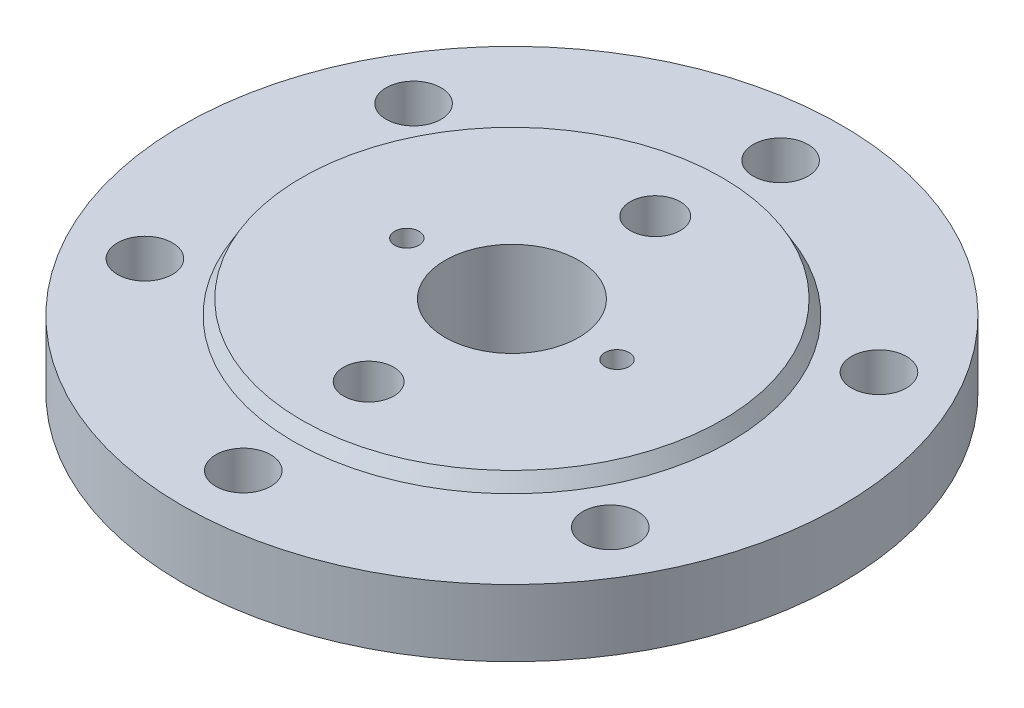
from build123d import *

# Parameters (mm, degrees)
CUT_EXTRUDE1_REACH     = 213.303
SKETCH2_R              = 11.5
M24_TAPPED_HOLE1_D     = 21
M24_TAPPED_HOLE1_DEPTH = 17.6909635
M24_TAPPED_HOLE1_TIP   = 6.3090365
M12_TAPPED_HOLE1_D     = 10.2
M12_TAPPED_HOLE1_DEPTH = 8.935610843
M12_TAPPED_HOLE1_TIP   = 3.064389157


with BuildPart() as part:
    # Sketch1 → Revolve1 (revolve)
    with BuildSketch(Plane.XY, mode=Mode.PRIVATE) as revolve1_sk:
        Polygon((14, -37.771370899), (14, -8.704913174), (28, -0.622009405), (28, 49.228629101), (88, 49.228629101), (91.464101615, 43.228629101), (138, 43.228629101), (138, 15.228629101), (59.901806028, 15.228629101), (59.901806028, 9.228629101), (35, -37.771370899), align=None)
    revolve(revolve1_sk.sketch.rotate(Axis((0, 62.992349216, 0), (0, -1, 0)), 90), axis=Axis((0, 62.992349216, 0), (0, -1, 0)))

    # Sketch2 → Cut-Extrude1 (cut, up to next)
    with BuildSketch(Plane(origin=(0, 43.228629101, 0), x_dir=(1, 0, 0), z_dir=(0, 1, 0)), mode=Mode.PRIVATE) as cut_extrude1_sk1:
        with Locations(Location((0, 112.5, 0), (0, 0, 270))):
            Circle(SKETCH2_R)
    cut_extrude1_tool1 = extrude(cut_extrude1_sk1.sketch, amount=-CUT_EXTRUDE1_REACH, mode=Mode.PRIVATE) & part.part
    # Sketch2 → Cut-Extrude1 (cut, up to next)
    with BuildSketch(Plane(origin=(0, 43.228629101, 0), x_dir=(1, 0, 0), z_dir=(0, 1, 0)), mode=Mode.PRIVATE) as cut_extrude1_sk2:
        with Locations(Location((97.427857926, 56.25, 0), (0, 0, 270))):
            Circle(SKETCH2_R)
    cut_extrude1_tool2 = extrude(cut_extrude1_sk2.sketch, amount=-CUT_EXTRUDE1_REACH, mode=Mode.PRIVATE) & part.part
    # Sketch2 → Cut-Extrude1 (cut, up to next)
    with BuildSketch(Plane(origin=(0, 43.228629101, 0), x_dir=(1, 0, 0), z_dir=(0, 1, 0)), mode=Mode.PRIVATE) as cut_extrude1_sk3:
        with Locations(Location((97.427857926, -56.25, 0), (0, 0, 270))):
            Circle(SKETCH2_R)
    cut_extrude1_tool3 = extrude(cut_extrude1_sk3.sketch, amount=-CUT_EXTRUDE1_REACH, mode=Mode.PRIVATE) & part.part
    # Sketch2 → Cut-Extrude1 (cut, up to next)
    with BuildSketch(Plane(origin=(0, 43.228629101, 0), x_dir=(1, 0, 0), z_dir=(0, 1, 0)), mode=Mode.PRIVATE) as cut_extrude1_sk4:
        with Locations(Location((0, -112.5, 0), (0, 0, 270))):
            Circle(SKETCH2_R)
    cut_extrude1_tool4 = extrude(cut_extrude1_sk4.sketch, amount=-CUT_EXTRUDE1_REACH, mode=Mode.PRIVATE) & part.part
    # Sketch2 → Cut-Extrude1 (cut, up to next)
    with BuildSketch(Plane(origin=(0, 43.228629101, 0), x_dir=(1, 0, 0), z_dir=(0, 1, 0)), mode=Mode.PRIVATE) as cut_extrude1_sk5:
        with Locations(Location((-97.427857926, -56.25, 0), (0, 0, 270))):
            Circle(SKETCH2_R)
    cut_extrude1_tool5 = extrude(cut_extrude1_sk5.sketch, amount=-CUT_EXTRUDE1_REACH, mode=Mode.PRIVATE) & part.part
    # Sketch2 → Cut-Extrude1 (cut, up to next)
    with BuildSketch(Plane(origin=(0, 43.228629101, 0), x_dir=(1, 0, 0), z_dir=(0, 1, 0)), mode=Mode.PRIVATE) as cut_extrude1_sk6:
        with Locations(Location((-97.427857926, 56.25, 0), (0, 0, 270))):
            Circle(SKETCH2_R)
    cut_extrude1_tool6 = extrude(cut_extrude1_sk6.sketch, amount=-CUT_EXTRUDE1_REACH, mode=Mode.PRIVATE) & part.part
    add(cut_extrude1_tool1.solids().sort_by_distance((0, 43.228629, -112.5))[0], mode=Mode.SUBTRACT)
    add(cut_extrude1_tool2.solids().sort_by_distance((97.427858, 43.228629, -56.25))[0], mode=Mode.SUBTRACT)
    add(cut_extrude1_tool3.solids().sort_by_distance((97.427858, 43.228629, 56.25))[0], mode=Mode.SUBTRACT)
    add(cut_extrude1_tool4.solids().sort_by_distance((0, 43.228629, 112.5))[0], mode=Mode.SUBTRACT)
    add(cut_extrude1_tool5.solids().sort_by_distance((-97.427858, 43.228629, 56.25))[0], mode=Mode.SUBTRACT)
    add(cut_extrude1_tool6.solids().sort_by_distance((-97.427858, 43.228629, -56.25))[0], mode=Mode.SUBTRACT)

    # M24 Tapped Hole1
    with Locations(Plane(origin=(0, 49.228629101, -60), x_dir=(0, 0, 1), z_dir=(0, 1, 0))):
        with Locations((0, 0), (120, 0)):
            Hole(M24_TAPPED_HOLE1_D / 2, depth=M24_TAPPED_HOLE1_DEPTH)
            with Locations((0, 0, -(M24_TAPPED_HOLE1_DEPTH + M24_TAPPED_HOLE1_TIP / 2))):  # 118° drill point
                Cone(0, M24_TAPPED_HOLE1_D / 2, M24_TAPPED_HOLE1_TIP, mode=Mode.SUBTRACT)

    # M12 Tapped Hole1
    with Locations(Plane(origin=(-44, 49.228629101, 0), x_dir=(0, 0, 1), z_dir=(0, 1, 0))):
        with Locations((0, 0), (0, 88)):
            Hole(M12_TAPPED_HOLE1_D / 2, depth=M12_TAPPED_HOLE1_DEPTH)
            with Locations((0, 0, -(M12_TAPPED_HOLE1_DEPTH + M12_TAPPED_HOLE1_TIP / 2))):  # 118° drill point
                Cone(0, M12_TAPPED_HOLE1_D / 2, M12_TAPPED_HOLE1_TIP, mode=Mode.SUBTRACT)


solid = part.part
